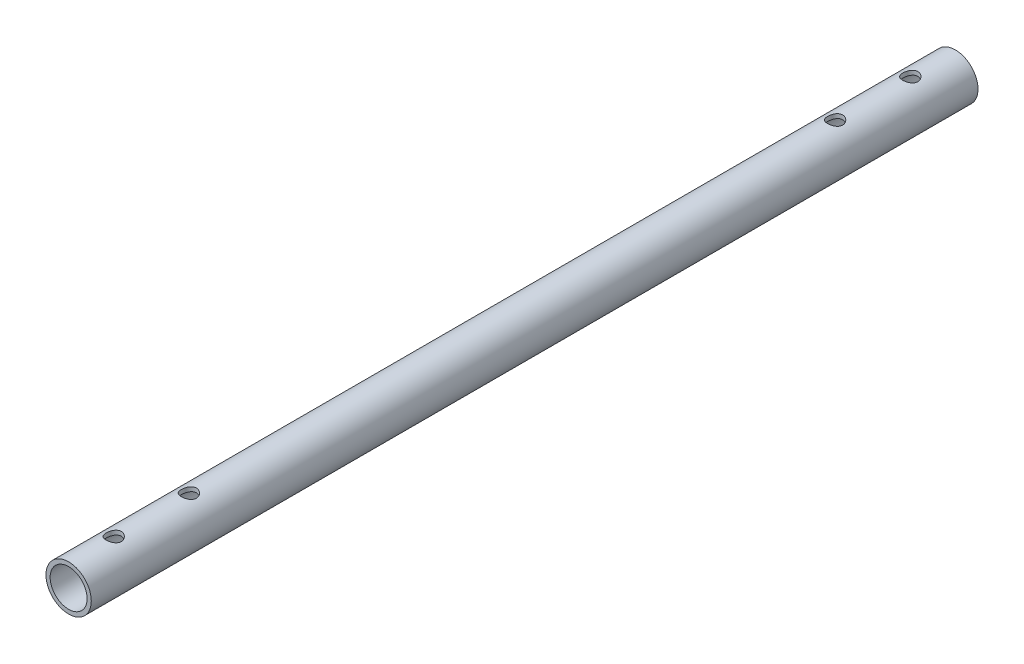
from build123d import *

# Parameters (mm, degrees)
SKETCH1_R           = 30.15
SKETCH1_R_2         = 24.61
EXTRUDE_THIN1_DEPTH = 590
SKETCH2_R           = 10.05
CUT_EXTRUDE1_DEPTH  = 592.538709638


with BuildPart() as part:
    # Sketch1 → Extrude-Thin1 (new, symmetric)
    with BuildSketch(Plane.XY):
        Circle(SKETCH1_R)
        Circle(SKETCH1_R_2, mode=Mode.SUBTRACT)
    extrude(amount=EXTRUDE_THIN1_DEPTH, both=True)

    # Sketch2 → Cut-Extrude1 (cut, symmetric)
    with BuildSketch(Plane(origin=(0, 0, 0), x_dir=(1, 0, 0), z_dir=(0, 1, 0))):
        with Locations(Location((0, 530, 0), (0, 0, 270))):
            Circle(SKETCH2_R)
        with Locations(Location((0, 430, 0), (0, 0, 270))):
            Circle(SKETCH2_R)
    cut_extrude1 = extrude(amount=CUT_EXTRUDE1_DEPTH, both=True, mode=Mode.SUBTRACT)

    # Mirror1: Cut-Extrude1 across plane
    add(cut_extrude1.mirror(Plane.XY), mode=Mode.SUBTRACT)


solid = part.part
